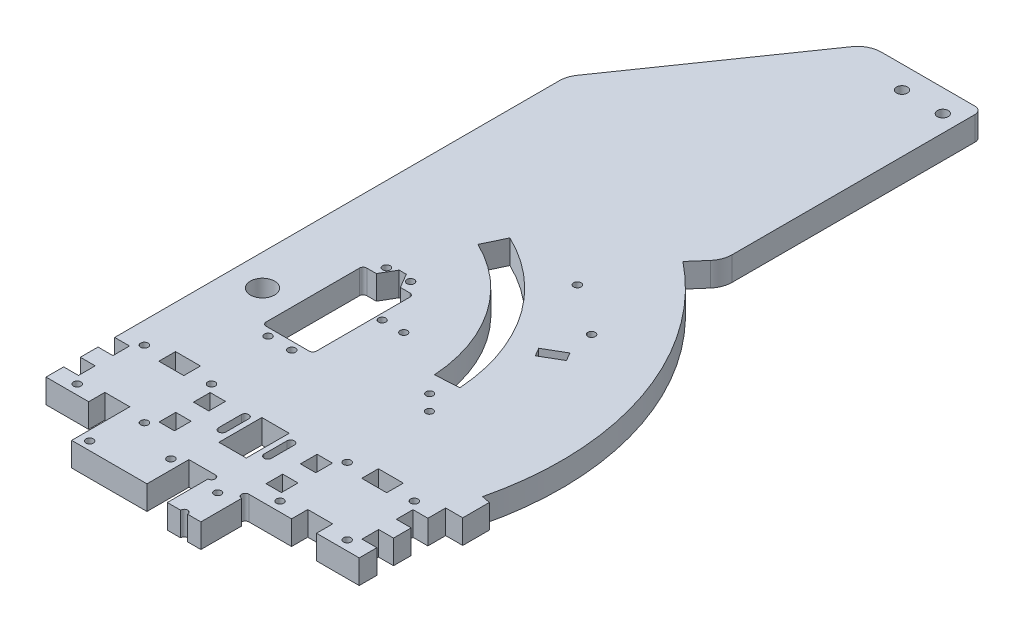
from build123d import *
from build123d.topology import SkipClean

# Parameters (mm, degrees)
SZKIC1_W                    = 100
SZKIC1_H                    = 195
DODANIE_WYCI_GNI_CIE1_DEPTH = 10
PRZENIE_CIAN_2_BY           = 90
PRZENIE_CIAN_3_BY           = 6.5
SZKIC5_W                    = 538.871297552
SZKIC5_H                    = 291.5
DODANIE_WYCI_GNI_CIE2_DEPTH = 10
SZKIC6_W                    = 504.280985844
SZKIC6_H                    = 293.478797047
WYTNIJ_WYCI_GNI_CIE1_DEPTH  = 10
WYTNIJ_WYCI_GNI_CIE2_DEPTH  = 10
SZKIC10_R                   = 1.55
WYTNIJ_WYCI_GNI_CIE5_DEPTH  = 576.399448492
SZKIC12_R                   = 1.55
SZKIC12_W                   = 6.4
SZKIC12_H                   = 6.95
SZKIC12_W_2                 = 10.4
WYTNIJ_WYCI_GNI_CIE6_DEPTH  = 10
WYTNIJ_WYCI_GNI_CIE7_DEPTH  = 10
WYTNIJ_WYCI_GNI_CIE8_DEPTH  = 10
SZKIC17_W                   = 14
SZKIC17_H                   = 20
SZKIC17_W_2                 = 31.39515585
SZKIC17_H_2                 = 17.5
DODANIE_WYCI_GNI_CIE3_DEPTH = 10
SZKIC19_R                   = 5.05
WYTNIJ_WYCI_GNI_CIE10_DEPTH = 10
DODANIE_WYCI_GNI_CIE4_DEPTH = 10
DODANIE_WYCI_GNI_CIE5_DEPTH = 10
SZKIC23_W                   = 2
SZKIC23_H                   = 7.361555581
SZKIC23_H_2                 = 7.376888838
DODANIE_WYCI_GNI_CIE6_DEPTH = 10
DODANIE_WYCI_GNI_CIE7_DEPTH = 10
WYTNIJ_WYCI_GNI_CIE14_DEPTH = 10
SZKIC27_R                   = 1.55
WYTNIJ_WYCI_GNI_CIE15_DEPTH = 10
SZKIC28_R                   = 1.55
WYTNIJ_WYCI_GNI_CIE16_DEPTH = 10
WYTNIJ_WYCI_GNI_CIE17_DEPTH = 10
SZKIC32_W                   = 6
SZKIC32_H                   = 36.064039604
WYTNIJ_WYCI_GNI_CIE18_DEPTH = 10
SZKIC33_R                   = 1.5
WYTNIJ_WYCI_GNI_CIE19_DEPTH = 10
SZKIC34_R                   = 1.5
WYTNIJ_WYCI_GNI_CIE20_DEPTH = 10
DODANIE_WYCI_GNI_CIE8_DEPTH = 10
SZKIC36_R                   = 1.5
WYTNIJ_WYCI_GNI_CIE21_DEPTH = 10
WYTNIJ_WYCI_GNI_CIE22_DEPTH = 10
DODANIE_WYCI_GNI_CIE9_DEPTH = 10
SZKIC8_R                    = 2.25
WYTNIJ_WYCI_GNI_CIE4_DEPTH  = 578.272908177
WYTNIJ_WYCI_GNI_CIE23_DEPTH = 10
WYTNIJ_WYCI_GNI_CIE24_DEPTH = 10


with BuildPart() as part:
    # Szkic1 → Dodanie-wyciągnięcie1 (new body)
    with BuildSketch(Plane(origin=(0, 0, 0), x_dir=(1, 0, 0), z_dir=(0, 1, 0))):
        with Locations((50, 97.5)):
            Rectangle(SZKIC1_W, SZKIC1_H)
    extrude(amount=DODANIE_WYCI_GNI_CIE1_DEPTH)

    # Przenieś ścianę2: a face moved outward by 90.0
    extrude(part.faces().sort_by_distance((50, 5, 0))[0], amount=PRZENIE_CIAN_2_BY, dir=(0, 0, 1))

    # Przenieś ścianę3: a face moved outward by 6.5
    extrude(part.faces().sort_by_distance((50, 5, -195))[0], amount=PRZENIE_CIAN_3_BY, dir=(0, 0, -1))

    # Szkic5 → Dodanie-wyciągnięcie2 (add)
    with BuildSketch(Plane.XZ):
        with Locations((-269.435648776, -55.75)):
            Rectangle(SZKIC5_W, SZKIC5_H)
    extrude(amount=-DODANIE_WYCI_GNI_CIE2_DEPTH)

    # Szkic6 → Wytnij-wyciągnięcie1 (cut)
    with BuildSketch(Plane(origin=(0, 10, 0), x_dir=(1, 0, 0), z_dir=(0, 1, 0))):
        with Locations((-152.140492922, 54.760601476)):
            Rectangle(SZKIC6_W, SZKIC6_H)
    extrude(amount=-WYTNIJ_WYCI_GNI_CIE1_DEPTH, mode=Mode.SUBTRACT)

    # Szkic3 → Wytnij-wyciągnięcie2 (cut)
    with BuildSketch(Plane.XZ):
        with BuildLine():
            Line((-404.280985844, -201.5), (-404.280985844, -3.866524585))
            ThreePointArc((-404.280985844, -3.866524585), (-431.207755685, -66.047337508), (-486.676552015, -104.966703684))
            Line((-486.676552015, -104.966703684), (-486.676552015, -201.5))
            Line((-486.676552015, -201.5), (-404.280985844, -201.5))
        make_face()
    extrude(amount=-WYTNIJ_WYCI_GNI_CIE2_DEPTH, mode=Mode.SUBTRACT)

    # Szkic10 → Wytnij-wyciągnięcie5 (cut, through all)
    with BuildSketch(Plane.XZ):
        with Locations(Location((-499.371297552, -20.502828658, 0), (0, 0, 270))):
            Circle(SZKIC10_R)
        with Locations(Location((-509.367646507, -20.419858069, 0), (0, 0, 270))):
            Circle(SZKIC10_R)
        with Locations(Location((-509.367646507, 28.934200753, 0), (0, 0, 270))):
            Circle(SZKIC10_R)
        with Locations(Location((-499.371297552, 29.017171342, 0), (0, 0, 270))):
            Circle(SZKIC10_R)
        with BuildLine():
            Line((-509.371297552, -16.242828658), (-505.871297552, -22.242828658))
            Line((-505.871297552, -22.242828658), (-502.871297552, -22.242828658))
            Line((-502.871297552, -22.242828658), (-499.371297552, -16.242828658))
            Line((-499.371297552, -16.242828658), (-495.371297552, -16.242828658))
            ThreePointArc((-495.371297552, -16.242828658), (-494.31063738, -15.80348883), (-493.871297552, -14.742828658))
            Line((-493.871297552, -14.742828658), (-493.871297552, 23.257171342))
            Line((-493.871297552, 23.257171342), (-493.871297552, 24.257171342))
            ThreePointArc((-493.871297552, 24.257171342), (-494.31063738, 25.317831513), (-495.371297552, 25.757171342))
            Line((-495.371297552, 25.757171342), (-513.371297552, 25.757171342))
            ThreePointArc((-513.371297552, 25.757171342), (-514.431957724, 25.317831513), (-514.871297552, 24.257171342))
            Line((-514.871297552, 24.257171342), (-514.871297552, 23.257171342))
            Line((-514.871297552, 23.257171342), (-514.871297552, -14.742828658))
            ThreePointArc((-514.871297552, -14.742828658), (-514.431957724, -15.80348883), (-513.371297552, -16.242828658))
            Line((-513.371297552, -16.242828658), (-509.371297552, -16.242828658))
        make_face()
    extrude(amount=-WYTNIJ_WYCI_GNI_CIE5_DEPTH, mode=Mode.SUBTRACT)

    # Szkic12 → Wytnij-wyciągnięcie6 (cut)
    with BuildSketch(Plane.XZ):
        with Locations(Location((-419.291297552, 86, 0), (0, 0, 270))):
            Circle(SZKIC12_R)
        with Locations(Location((-419.291297552, 58, 0), (0, 0, 270))):
            Circle(SZKIC12_R)
        with Locations(Location((-531.871297552, 86, 0), (0, 0, 270))):
            Circle(SZKIC12_R)
        with Locations(Location((-531.871297552, 58, 0), (0, 0, 270))):
            Circle(SZKIC12_R)
        with Locations(Location((-447.291297552, 86, 0), (0, 0, 270))):
            Circle(SZKIC12_R)
        with Locations(Location((-447.291297552, 58, 0), (0, 0, 270))):
            Circle(SZKIC12_R)
        with Locations(Location((-503.871297552, 58, 0), (0, 0, 270))):
            Circle(SZKIC12_R)
        with Locations(Location((-503.871297552, 86, 0), (0, 0, 270))):
            Circle(SZKIC12_R)
        with Locations((-537.871297552, 64.836555581)):
            Rectangle(SZKIC12_W, SZKIC12_H)
        with Locations((-537.871297552, 79.163444419)):
            Rectangle(SZKIC12_W, SZKIC12_H)
        with Locations((-517.871297552, 57.275)):
            Rectangle(SZKIC12_W_2, SZKIC12_H)
        with Locations((-517.871297552, 86.725)):
            Rectangle(SZKIC12_W_2, SZKIC12_H)
        with Locations((-497.871297552, 64.836555581)):
            Rectangle(SZKIC12_W, SZKIC12_H)
        with Locations((-497.871297552, 79.163444419)):
            Rectangle(SZKIC12_W, SZKIC12_H)
        with Locations((-453.280985852, 79.163444419)):
            Rectangle(SZKIC12_W, SZKIC12_H)
        with Locations((-453.280985852, 64.836555581)):
            Rectangle(SZKIC12_W, SZKIC12_H)
        with Locations((-433.280985852, 86.725)):
            Rectangle(SZKIC12_W_2, SZKIC12_H)
        with Locations((-433.280985852, 57.275)):
            Rectangle(SZKIC12_W_2, SZKIC12_H)
        with Locations((-413.280985852, 79.163444419)):
            Rectangle(SZKIC12_W, SZKIC12_H)
        with Locations((-413.280985852, 64.836555581)):
            Rectangle(SZKIC12_W, SZKIC12_H)
    extrude(amount=-WYTNIJ_WYCI_GNI_CIE6_DEPTH, mode=Mode.SUBTRACT)

    # Szkic14 → Wytnij-wyciągnięcie7 (cut)
    with BuildSketch(Plane(origin=(0, 10, 0), x_dir=(1, 0, 0), z_dir=(0, 1, 0))):
        Polygon((-469.876141702, -75.5), (-469.876141702, -77.5), (-481.276141702, -77.5), (-481.276141702, -75.5), (-481.276141702, -61.1), (-481.276141702, -59.6), (-469.876141702, -59.6), (-469.876141702, -61.1), align=None)
        with BuildLine():
            Line((-486.626141702, -64.3), (-486.626141702, -62.8))
            ThreePointArc((-486.626141702, -62.8), (-485.076141702, -61.25), (-483.526141702, -62.8))
            Line((-483.526141702, -62.8), (-483.526141702, -64.3))
            Line((-483.526141702, -64.3), (-483.526141702, -72.3))
            ThreePointArc((-483.526141702, -72.3), (-485.076141702, -73.85), (-486.626141702, -72.3))
            Line((-486.626141702, -72.3), (-486.626141702, -64.3))
        make_face()
        with BuildLine():
            Line((-467.626141702, -64.3), (-467.626141702, -62.8))
            ThreePointArc((-467.626141702, -62.8), (-466.076141702, -61.25), (-464.526141702, -62.8))
            Line((-464.526141702, -62.8), (-464.526141702, -64.3))
            Line((-464.526141702, -64.3), (-464.526141702, -72.3))
            ThreePointArc((-464.526141702, -72.3), (-466.076141702, -73.85), (-467.626141702, -72.3))
            Line((-467.626141702, -72.3), (-467.626141702, -64.3))
        make_face()
    extrude(amount=-WYTNIJ_WYCI_GNI_CIE7_DEPTH, mode=Mode.SUBTRACT)

    # Szkic16 → Wytnij-wyciągnięcie8 (cut)
    with BuildSketch(Plane.XZ):
        with BuildLine():
            Line((-460.710584444, 8.205461744), (-450.733224367, 7.532939705))
            ThreePointArc((-450.733224367, 7.532939705), (-463.856052338, -30.619230046), (-494.412087357, -56.96548964))
            Line((-494.412087357, -56.96548964), (-498.73984114, -47.95047177))
            ThreePointArc((-498.73984114, -47.95047177), (-472.136051119, -25.011947265), (-460.710584444, 8.205461744))
        make_face()
    extrude(amount=-WYTNIJ_WYCI_GNI_CIE8_DEPTH, mode=Mode.SUBTRACT)

    # Szkic17 → Dodanie-wyciągnięcie3 (add)
    with BuildSketch(Plane.XZ):
        with Locations((-463.291297552, 100)):
            Rectangle(SZKIC17_W, SZKIC17_H)
        with Locations((-496.973719627, 98.75)):
            Rectangle(SZKIC17_W_2, SZKIC17_H_2)
    extrude(amount=-DODANIE_WYCI_GNI_CIE3_DEPTH)

    # Szkic19 → Wytnij-wyciągnięcie10 (cut)
    with BuildSketch(Plane.XZ):
        with Locations(Location((-527.871297552, 12.732416704, 0), (0, 0, 270))):
            Circle(SZKIC19_R)
    extrude(amount=-WYTNIJ_WYCI_GNI_CIE10_DEPTH, mode=Mode.SUBTRACT)


with BuildPart() as body_2:
    # Szkic20 → Dodanie-wyciągnięcie4 (new body)
    with BuildSketch(Plane.XZ):
        with BuildLine():
            Line((-538.871297552, 53.8), (-538.921297552, 53.8))
            ThreePointArc((-538.921297552, 53.8), (-540.300155775, 53.228858224), (-540.871297552, 51.85))
            Line((-540.871297552, 51.85), (-540.871297552, -199.55))
            ThreePointArc((-540.871297552, -199.55), (-540.300155775, -200.928858223), (-538.921297552, -201.5))
            Line((-538.921297552, -201.5), (-538.871297552, -201.5))
            Line((-538.871297552, -201.5), (-538.871297552, 53.8))
        make_face()
    extrude(amount=-DODANIE_WYCI_GNI_CIE4_DEPTH)

    # Połącz1: union part
    add(part.part)

    # Szkic22 → Dodanie-wyciągnięcie5 (add)
    with BuildSketch(Plane(origin=(0, 10, 0), x_dir=(1, 0, 0), z_dir=(0, 1, 0))):
        with BuildLine():
            Line((-486.676552015, 201.5), (-477.676552015, 201.5))
            ThreePointArc((-477.676552015, 201.5), (-476.262338452, 200.914213562), (-475.676552015, 199.5))
            Line((-475.676552015, 199.5), (-475.676552015, 114.825601584))
            ThreePointArc((-475.676552015, 114.825601584), (-475.344505385, 113.722002221), (-474.458620461, 112.984849307))
            ThreePointArc((-474.458620461, 112.984849307), (-456.584900162, 103.783653408), (-440.255262813, 92.058687422))
            ThreePointArc((-440.255262813, 92.058687422), (-439.541651301, 90.642849677), (-440.082750048, 89.1525309))
            Line((-440.082750048, 89.1525309), (-440.97812243, 88.202605053))
            Line((-440.97812243, 88.202605053), (-448.314520611, 80.419213026))
            Line((-448.314520611, 80.419213026), (-486.676552015, 104.966703684))
            Line((-486.676552015, 104.966703684), (-486.676552015, 201.5))
        make_face()
    extrude(amount=-DODANIE_WYCI_GNI_CIE5_DEPTH)

    # Szkic23 → Dodanie-wyciągnięcie6 (add)
    with BuildSketch(Plane(origin=(0, 0, 0), x_dir=(-1, 0, 0), z_dir=(0, -1, 0))):
        with Locations((539.871297552, -86.319222209)):
            Rectangle(SZKIC23_W, SZKIC23_H)
        with Locations((539.871297552, -72)):
            Rectangle(SZKIC23_W, SZKIC23_H_2)
        Polygon((538.871297552, -61.361555581), (540.871297552, -61.361555581), (540.871297552, -51.85), (538.871297552, -53.8), align=None)
    extrude(amount=-DODANIE_WYCI_GNI_CIE6_DEPTH)

    # Szkic25 → Dodanie-wyciągnięcie7 (add)
    with BuildSketch(Plane(origin=(0, 10, 0), x_dir=(1, 0, 0), z_dir=(0, 1, 0))):
        with BuildLine():
            Line((-404.280985844, 3.866524585), (-404.280985844, -29.331357993))
            ThreePointArc((-404.280985844, -29.331357993), (-403.171297552, -12.732416704), (-404.280985844, 3.866524585))
        make_face()
    extrude(amount=-DODANIE_WYCI_GNI_CIE7_DEPTH)

    # Szkic26 → Wytnij-wyciągnięcie14 (cut)
    with BuildSketch(Plane(origin=(0, 10, 0), x_dir=(1, 0, 0), z_dir=(0, 1, 0))):
        with BuildLine():
            Line((-399.999487508, -49.976244328), (-396.142043582, -50.913494939))
            Line((-396.142043582, -50.913494939), (-395.739531483, -31.62269798))
            Line((-395.739531483, -31.62269798), (-404.280985844, -29.331357993))
            ThreePointArc((-404.280985844, -29.331357993), (-405.910770587, -38.727028886), (-408.253764049, -47.970686792))
            Line((-408.253764049, -47.970686792), (-399.999487508, -49.976244328))
        make_face()
    extrude(amount=-WYTNIJ_WYCI_GNI_CIE14_DEPTH, mode=Mode.SUBTRACT)

    # Szkic27 → Wytnij-wyciągnięcie15 (cut)
    with SkipClean():  # the faces are left unmerged after this step: merging them gives an invalid solid
        with BuildSketch(Plane.XZ):
            with Locations(Location((-508.676141702, 104, 0), (0, 0, 270))):
                Circle(SZKIC27_R)
            with Locations(Location((-485.276141702, 93.5, 0), (0, 0, 270))):
                Circle(SZKIC27_R)
        extrude(amount=-WYTNIJ_WYCI_GNI_CIE15_DEPTH, mode=Mode.SUBTRACT)

    # Szkic28 → Wytnij-wyciągnięcie16 (cut)
    with SkipClean():  # the faces are left unmerged after this step: merging them gives an invalid solid
        with BuildSketch(Plane(origin=(0, 10, 0), x_dir=(1, 0, 0), z_dir=(0, 1, 0))):
            with Locations(Location((-463.383939547, 54.075272363, 0), (0, 0, 270))):
                Circle(SZKIC28_R)
            with Locations(Location((-442.537108774, 39.134735334, 0), (0, 0, 270))):
                Circle(SZKIC28_R)
        extrude(amount=-WYTNIJ_WYCI_GNI_CIE16_DEPTH, mode=Mode.SUBTRACT)

    # Szkic29 → Wytnij-wyciągnięcie17 (cut)
    with SkipClean():  # the faces are left unmerged after this step: merging them gives an invalid solid
        with BuildSketch(Plane.XZ):
            Polygon((-440.34456368, -27.914430257), (-438.332188062, -24.457503244), (-446.542389718, -19.678111152), (-448.554765336, -23.135038165), align=None)
        extrude(amount=-WYTNIJ_WYCI_GNI_CIE17_DEPTH, mode=Mode.SUBTRACT)

    # Szkic32 → Wytnij-wyciągnięcie18 (cut)
    with BuildSketch(Plane(origin=(0, 10, 0), x_dir=(1, 0, 0), z_dir=(0, 1, 0))):
        with Locations((-407.280985844, -71.967980198)):
            Rectangle(SZKIC32_W, SZKIC32_H)
    extrude(amount=-WYTNIJ_WYCI_GNI_CIE18_DEPTH, mode=Mode.SUBTRACT)

    # Szkic33 → Wytnij-wyciągnięcie19 (cut)
    with SkipClean():  # the faces are left unmerged after this step: merging them gives an invalid solid
        with BuildSketch(Plane(origin=(0, 0, 0), x_dir=(-1, 0, 0), z_dir=(0, -1, 0))):
            with Locations(Location((454.871297552, -16.032233193, 0), (0, 0, 90))):
                Circle(SZKIC33_R)
            with Locations(Location((448.562586215, -22.45096837, 0), (0, 0, 90))):
                Circle(SZKIC33_R)
            with Locations(Location((491.371297552, 0.674313905, 0), (0, 0, 90))):
                Circle(SZKIC33_R)
            with Locations(Location((482.371297552, 0.674313905, 0), (0, 0, 90))):
                Circle(SZKIC33_R)
        extrude(amount=-WYTNIJ_WYCI_GNI_CIE19_DEPTH, mode=Mode.SUBTRACT)

    # Szkic34 → Wytnij-wyciągnięcie20 (cut)
    with BuildSketch(Plane.XZ):
        with Locations((-456.291297552, 91.5)):
            Circle(SZKIC34_R)
        with Locations((-470.291297552, 91.5)):
            Circle(SZKIC34_R)
    extrude(amount=-WYTNIJ_WYCI_GNI_CIE20_DEPTH, mode=Mode.SUBTRACT)

    # Szkic35 → Dodanie-wyciągnięcie8 (add)
    with SkipClean():  # the faces are left unmerged after this step: merging them gives an invalid solid
        with BuildSketch(Plane(origin=(0, 10, 0), x_dir=(1, 0, 0), z_dir=(0, 1, 0))):
            with BuildLine():
                Line((-408.253764049, -47.970686792), (-404.280985844, -48.935960396))
                Line((-404.280985844, -48.935960396), (-404.280985844, -53.935960396))
                Line((-404.280985844, -53.935960396), (-403.171297552, -53.935960396))
                Line((-403.171297552, -53.935960396), (-403.171297552, -42.871250492))
                Line((-403.171297552, -42.871250492), (-406.694237546, -42.163864651))
                ThreePointArc((-406.694237546, -42.163864651), (-407.438997642, -45.076676448), (-408.253764049, -47.970686792))
            make_face()
            with BuildLine():
                Line((-446.804473755, 82.021264383), (-440.082750048, 89.1525309))
                ThreePointArc((-440.082750048, 89.1525309), (-439.541651301, 90.642849677), (-440.255262813, 92.058687422))
                ThreePointArc((-440.255262813, 92.058687422), (-439.048197124, 91.037530186), (-437.853031977, 90.002469825))
                Line((-437.853031977, 90.002469825), (-446.019219621, 81.343761675))
                ThreePointArc((-446.019219621, 81.343761675), (-446.411142338, 81.683329401), (-446.804473755, 82.021264383))
            make_face()
        extrude(amount=-DODANIE_WYCI_GNI_CIE8_DEPTH)

    # Szkic36 → Wytnij-wyciągnięcie21 (cut)
    with BuildSketch(Plane(origin=(0, 10, 0), x_dir=(1, 0, 0), z_dir=(0, 1, 0))):
        with Locations(Location((-463.291297552, -96, 0), (0, 0, 270))):
            Circle(SZKIC36_R)
        with Locations((-463.291297552, -110)):
            Circle(SZKIC36_R)
    extrude(amount=-WYTNIJ_WYCI_GNI_CIE21_DEPTH, mode=Mode.SUBTRACT)

    # Szkic37 → Wytnij-wyciągnięcie22 (cut)
    with BuildSketch(Plane(origin=(0, 10, 0), x_dir=(1, 0, 0), z_dir=(0, 1, 0))):
        with BuildLine():
            Line((-441.480659942, 94.099953522), (-449.821071385, 84.521129223))
            ThreePointArc((-449.821071385, 84.521129223), (-447.904362947, 82.95132993), (-446.019219621, 81.343761675))
            Line((-446.019219621, 81.343761675), (-437.853031977, 90.002469825))
            Line((-437.853031977, 90.002469825), (-441.480659942, 94.099953522))
        make_face()
    extrude(amount=-WYTNIJ_WYCI_GNI_CIE22_DEPTH, mode=Mode.SUBTRACT)

    # Szkic38 → Dodanie-wyciągnięcie9 (add)
    with BuildSketch(Plane(origin=(0, 10, 0), x_dir=(1, 0, 0), z_dir=(0, 1, 0))):
        with BuildLine():
            Line((-442.005302961, 93.49740971), (-442.005302961, 198.5))
            ThreePointArc((-442.005302961, 198.5), (-442.883982617, 200.621320344), (-445.005302961, 201.5))
            Line((-445.005302961, 201.5), (-477.676552015, 201.5))
            ThreePointArc((-477.676552015, 201.5), (-476.262338452, 200.914213562), (-475.676552015, 199.5))
            Line((-475.676552015, 199.5), (-475.676552015, 114.825601584))
            ThreePointArc((-475.676552015, 114.825601584), (-475.344505385, 113.722002221), (-474.458620461, 112.984849307))
            ThreePointArc((-474.458620461, 112.984849307), (-457.553610077, 104.370819269), (-442.005302961, 93.49740971))
        make_face()
    extrude(amount=-DODANIE_WYCI_GNI_CIE9_DEPTH)

    # Szkic8 → Wytnij-wyciągnięcie4 (cut, through all)
    with SkipClean():  # the faces are left unmerged after this step: merging them gives an invalid solid
        with BuildSketch(Plane.XZ):
            with Locations(Location((-466.055302961, -192.1, 0), (0, 0, 270))):
                Circle(SZKIC8_R)
            with Locations(Location((-449.055302961, -192.1, 0), (0, 0, 270))):
                Circle(SZKIC8_R)
        extrude(amount=-WYTNIJ_WYCI_GNI_CIE4_DEPTH, mode=Mode.SUBTRACT)

    # Szkic39 → Wytnij-wyciągnięcie23 (cut)
    with BuildSketch(Plane.XZ):
        with BuildLine():
            Line((-538.921297552, -201.5), (-484.03966735, -201.5))
            ThreePointArc((-484.03966735, -201.5), (-488.6757528, -200.360401328), (-492.255182886, -197.20134234))
            Line((-492.255182886, -197.20134234), (-539.086813088, -129.717938862))
            ThreePointArc((-539.086813088, -129.717938862), (-540.414754875, -127.003638926), (-540.871297552, -124.016596522))
            Line((-540.871297552, -124.016596522), (-540.871297552, -199.55))
            ThreePointArc((-540.871297552, -199.55), (-540.300155775, -200.928858223), (-538.921297552, -201.5))
        make_face()
    extrude(amount=-WYTNIJ_WYCI_GNI_CIE23_DEPTH, mode=Mode.SUBTRACT)

    # Szkic40 → Wytnij-wyciągnięcie24 (cut)
    with BuildSketch(Plane.XZ):
        with BuildLine():
            Line((-442.005302961, -97.240885208), (-442.005302961, -93.49740971))
            Line((-442.005302961, -93.49740971), (-444.463537367, -90.67416824))
            ThreePointArc((-444.463537367, -90.67416824), (-442.640003821, -93.735008423), (-442.005302961, -97.240885208))
        make_face()
    extrude(amount=-WYTNIJ_WYCI_GNI_CIE24_DEPTH, mode=Mode.SUBTRACT)


solid = body_2.part
